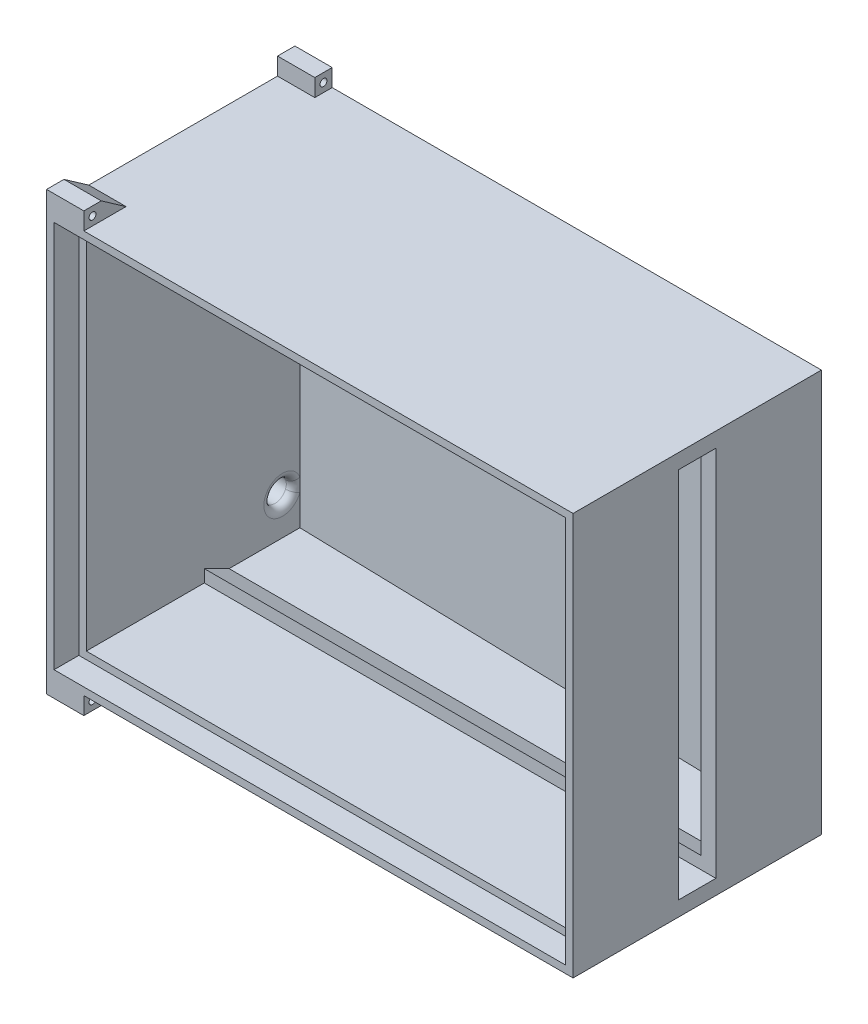
from build123d import *

# Parameters (mm, degrees)
SKETCH1_W           = 212
SKETCH1_H           = 162
SKETCH1_W_2         = 200
SKETCH1_H_2         = 150
BOSS_EXTRUDE1_DEPTH = 100
SKETCH1_4_W         = 200
SKETCH1_4_H         = 150
BOSS_EXTRUDE2_DEPTH = 4
SKETCH2_W           = 206
SKETCH2_H           = 156
SKETCH2_W_2         = 200
SKETCH2_H_2         = 150
CUT_EXTRUDE1_DEPTH  = 10
SKETCH3_W           = 15
SKETCH3_H           = 150
CUT_EXTRUDE2_DEPTH  = 200
BOSS_EXTRUDE3_DEPTH = 200
BOSS_EXTRUDE4_DEPTH = 150
SKETCH6_R           = 3
SKETCH6_R_2         = 1.4
BOSS_EXTRUDE5_DEPTH = 3
CUT_EXTRUDE3_START  = -4
SKETCH6_3_R         = 1.4
CUT_EXTRUDE3_DEPTH  = 4
SKETCH6_5_R         = 4.5
CUT_EXTRUDE4_DEPTH  = 6
BOSS_EXTRUDE6_START = 10
SKETCH6_6_R         = 5.75
SKETCH6_6_R_2       = 4.5
BOSS_EXTRUDE6_DEPTH = 10
FILLET1_R           = 3
SKETCH6_8_R         = 1.4
SKETCH6_8_W         = 7
SKETCH6_8_H         = 7
BOSS_EXTRUDE7_DEPTH = 15


with BuildPart() as part:
    # Sketch1 → Boss-Extrude1 (new body)
    with BuildSketch(Plane.XY):
        Rectangle(SKETCH1_W, SKETCH1_H)
        Rectangle(SKETCH1_W_2, SKETCH1_H_2, mode=Mode.SUBTRACT)
    extrude(amount=BOSS_EXTRUDE1_DEPTH)

    # Sketch1<4> → Boss-Extrude2 (add)
    with BuildSketch(Plane.XY):
        Rectangle(SKETCH1_4_W, SKETCH1_4_H)
    extrude(amount=BOSS_EXTRUDE2_DEPTH)

    # Sketch2 → Cut-Extrude1 (cut)
    with BuildSketch(Plane.XY.offset(100)):
        Rectangle(SKETCH2_W, SKETCH2_H)
        Rectangle(SKETCH2_W_2, SKETCH2_H_2, mode=Mode.SUBTRACT)
    extrude(amount=-CUT_EXTRUDE1_DEPTH, mode=Mode.SUBTRACT)

    # Sketch3 → Cut-Extrude2 (cut)
    with BuildSketch(Plane(origin=(106, 0, 0), x_dir=(0, 0, -1), z_dir=(1, 0, 0))):
        with Locations((-50, 0)):
            Rectangle(SKETCH3_W, SKETCH3_H)
    extrude(amount=-CUT_EXTRUDE2_DEPTH, mode=Mode.SUBTRACT)

    # Sketch4 → Boss-Extrude3 (add)
    with BuildSketch(Plane.ZY.offset(-100)):
        Polygon((42.5, 75), (42.5, 70), (32.5, 75), align=None)
        Polygon((32.5, -75), (42.5, -75), (42.5, -70), align=None)
    extrude(amount=BOSS_EXTRUDE3_DEPTH)

    # Sketch5 → Boss-Extrude4 (add)
    with BuildSketch(Plane.XZ.offset(-75)):
        Polygon((100, 9), (-100, 4), (100, 4), align=None)
    extrude(amount=BOSS_EXTRUDE4_DEPTH)

    # Sketch6 → Boss-Extrude5 (add)
    # profile 1 of 12: a face of its own
    with BuildSketch(Plane.ZY.offset(106)):
        with Locations((67.5, -32)):
            Circle(SKETCH6_R)
        with Locations((67.5, -32)):
            Circle(SKETCH6_R_2, mode=Mode.SUBTRACT)
    # profile 2 of 12: a face of its own
    with BuildSketch(Plane.ZY.offset(106)):
        with Locations((67.5, -51)):
            Circle(SKETCH6_R)
        with Locations((67.5, -51)):
            Circle(SKETCH6_R_2, mode=Mode.SUBTRACT)
    # profile 3 of 12: a face of its own
    with BuildSketch(Plane.ZY.offset(106)):
        with Locations((32.5, -51)):
            Circle(SKETCH6_R)
        with Locations((32.5, -51)):
            Circle(SKETCH6_R_2, mode=Mode.SUBTRACT)
    # profile 4 of 12: a face of its own
    with BuildSketch(Plane.ZY.offset(106)):
        with Locations((32.5, -32)):
            Circle(SKETCH6_R)
        with Locations((32.5, -32)):
            Circle(SKETCH6_R_2, mode=Mode.SUBTRACT)
    # profile 5 of 12: a face of its own
    with BuildSketch(Plane.ZY.offset(106)):
        with Locations((42.5, 31)):
            Circle(SKETCH6_R)
        with Locations((42.5, 31)):
            Circle(SKETCH6_R_2, mode=Mode.SUBTRACT)
    # profile 6 of 12: a face of its own
    with BuildSketch(Plane.ZY.offset(106)):
        with Locations((42.5, -13)):
            Circle(SKETCH6_R)
        with Locations((42.5, -13)):
            Circle(SKETCH6_R_2, mode=Mode.SUBTRACT)
    # profile 7 of 12: a face of its own
    with BuildSketch(Plane.ZY.offset(106)):
        with Locations((57.5, -13)):
            Circle(SKETCH6_R)
        with Locations((57.5, -13)):
            Circle(SKETCH6_R_2, mode=Mode.SUBTRACT)
    # profile 8 of 12: a face of its own
    with BuildSketch(Plane.ZY.offset(106)):
        with Locations((57.5, 31)):
            Circle(SKETCH6_R)
        with Locations((57.5, 31)):
            Circle(SKETCH6_R_2, mode=Mode.SUBTRACT)
    # profile 9 of 12: a face of its own
    with BuildSketch(Plane.ZY.offset(106)):
        with Locations((14.5, 31)):
            Circle(SKETCH6_R)
        with Locations((14.5, 31)):
            Circle(SKETCH6_R_2, mode=Mode.SUBTRACT)
    # profile 10 of 12: a face of its own
    with BuildSketch(Plane.ZY.offset(106)):
        with Locations((14.5, -13)):
            Circle(SKETCH6_R)
        with Locations((14.5, -13)):
            Circle(SKETCH6_R_2, mode=Mode.SUBTRACT)
    # profile 11 of 12: a face of its own
    with BuildSketch(Plane.ZY.offset(106)):
        with Locations((85.5, -13)):
            Circle(SKETCH6_R)
        with Locations((85.5, -13)):
            Circle(SKETCH6_R_2, mode=Mode.SUBTRACT)
    # profile 12 of 12: a face of its own
    with BuildSketch(Plane.ZY.offset(106)):
        with Locations((85.5, 31)):
            Circle(SKETCH6_R)
        with Locations((85.5, 31)):
            Circle(SKETCH6_R_2, mode=Mode.SUBTRACT)
    extrude(amount=BOSS_EXTRUDE5_DEPTH)

    # Sketch6<3> → Cut-Extrude3 (cut)
    with BuildSketch(Plane.ZY.offset(106).offset(CUT_EXTRUDE3_START)):
        with Locations((67.5, -51)):
            Circle(SKETCH6_3_R)
        with Locations((67.5, -32)):
            Circle(SKETCH6_3_R)
        with Locations((32.5, -32)):
            Circle(SKETCH6_3_R)
        with Locations((32.5, -51)):
            Circle(SKETCH6_3_R)
        with Locations((42.5, 31)):
            Circle(SKETCH6_3_R)
        with Locations((42.5, -13)):
            Circle(SKETCH6_3_R)
        with Locations((57.5, -13)):
            Circle(SKETCH6_3_R)
        with Locations((57.5, 31)):
            Circle(SKETCH6_3_R)
    extrude(amount=CUT_EXTRUDE3_DEPTH, mode=Mode.SUBTRACT)

    # Sketch6<5> → Cut-Extrude4 (cut)
    with BuildSketch(Plane.ZY.offset(106)):
        with Locations((11, -60)):
            Circle(SKETCH6_5_R)
    extrude(amount=-CUT_EXTRUDE4_DEPTH, mode=Mode.SUBTRACT)

    # Sketch6<6> → Boss-Extrude6 (add)
    with BuildSketch(Plane.ZY.offset(106).offset(BOSS_EXTRUDE6_START)):
        with Locations((11, -60)):
            Circle(SKETCH6_6_R)
        with Locations((11, -60)):
            Circle(SKETCH6_6_R_2, mode=Mode.SUBTRACT)
    extrude(amount=-BOSS_EXTRUDE6_DEPTH)

    # Fillet1
    fillet1_edges = [part.edges().sort_by_distance(p)[0] for p in [
        (-100, -60, 6.5),
    ]]
    fillet(fillet1_edges, radius=FILLET1_R)

    # Sketch6<8> → Boss-Extrude7 (add)
    # profile 1 of 4: a face of its own
    with BuildSketch(Plane.ZY.offset(106)):
        Polygon((100, -81), (83, -81), (93, -88), (100, -88), align=None)
        with Locations((96.5, -84.5)):
            Circle(SKETCH6_8_R, mode=Mode.SUBTRACT)
    # profile 2 of 4: a face of its own
    with BuildSketch(Plane.ZY.offset(106)):
        with Locations((3.5, -84.5)):
            Rectangle(SKETCH6_8_W, SKETCH6_8_H)
        with Locations((3.5, -84.5)):
            Circle(SKETCH6_8_R, mode=Mode.SUBTRACT)
    # profile 3 of 4: a face of its own
    with BuildSketch(Plane.ZY.offset(106)):
        Polygon((93, 88), (83, 81), (100, 81), (100, 88), align=None)
        with Locations((96.5, 84.5)):
            Circle(SKETCH6_8_R, mode=Mode.SUBTRACT)
    # profile 4 of 4: a face of its own
    with BuildSketch(Plane.ZY.offset(106)):
        with Locations((3.5, 84.5)):
            Rectangle(SKETCH6_8_W, SKETCH6_8_H)
        with Locations((3.5, 84.5)):
            Circle(SKETCH6_8_R, mode=Mode.SUBTRACT)
    extrude(amount=-BOSS_EXTRUDE7_DEPTH)


solid = part.part
